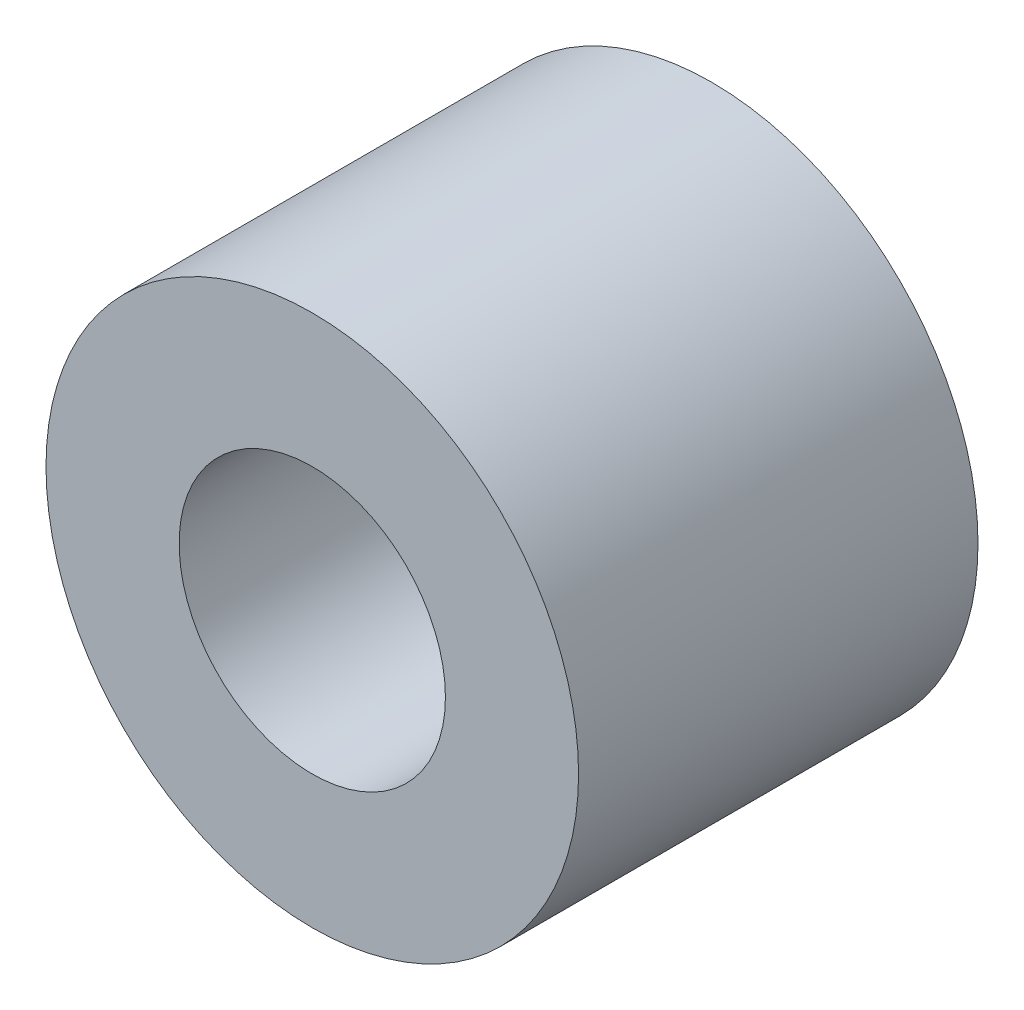
from build123d import *

# Parameters (mm, degrees)
SKETCH_1_R      = 4
SKETCH_1_R_2    = 2
EXTRUDE_1_DEPTH = 3


with BuildPart() as part:
    # 草图1 → 凸台-拉伸1 (new, symmetric)
    with BuildSketch(Plane.XY):
        Circle(SKETCH_1_R)
        Circle(SKETCH_1_R_2, mode=Mode.SUBTRACT)
    extrude(amount=EXTRUDE_1_DEPTH, both=True)


solid = part.part
